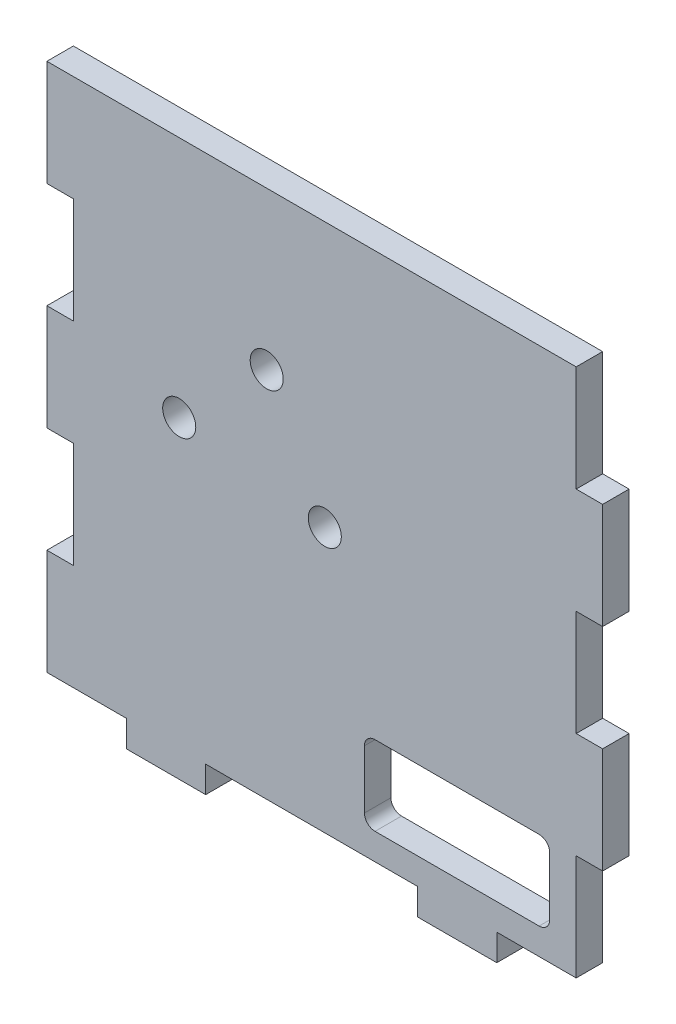
from build123d import *

# Parameters (mm, degrees)
BOXSIDE_DEPTH      = 6.35
SKETCH2_R          = 3.96875
CUT_EXTRUDE1_DEPTH = 99.986703653
SKETCH3_W          = 44.45
SKETCH3_H          = 19.05
CUT_EXTRUDE2_DEPTH = 99.986703653
FILLET1_R          = 2.54


with BuildPart() as part:
    # Sketch1 → BOXSIDE (new body)
    with BuildSketch(Plane.XY):
        Polygon((-63.5, 38.1), (-63.5, 63.5), (63.5, 63.5), (63.5, 38.1), (69.85, 38.1), (69.85, 12.7), (63.5, 12.7), (63.5, -12.7), (69.85, -12.7), (69.85, -38.1), (63.5, -38.1), (63.5, -63.5), (44.45, -63.5), (44.45, -69.85), (25.4, -69.85), (25.4, -63.5), (-25.4, -63.5), (-25.4, -69.85), (-44.45, -69.85), (-44.45, -63.5), (-63.5, -63.5), (-63.5, -38.1), (-57.15, -38.1), (-57.15, -12.7), (-63.5, -12.7), (-63.5, 12.7), (-57.15, 12.7), (-57.15, 38.1), align=None)
    extrude(amount=BOXSIDE_DEPTH)

    # Sketch2 → Cut-Extrude1 (cut, through all)
    with BuildSketch(Plane.XY):
        with Locations(Location((-10.755250883, 25.77544668, 0), (0, 0, 180))):
            Circle(SKETCH2_R)
        with Locations((3.175, 0)):
            Circle(SKETCH2_R)
        with Locations((-31.75, 5.339056325)):
            Circle(SKETCH2_R)
    extrude(amount=CUT_EXTRUDE1_DEPTH, mode=Mode.SUBTRACT)

    # Sketch3 → Cut-Extrude2 (cut, through all)
    with BuildSketch(Plane(origin=(0, 0, 0), x_dir=(-1, 0, 0), z_dir=(0, 0, -1))):
        with Locations((-34.925, -47.625)):
            Rectangle(SKETCH3_W, SKETCH3_H)
    extrude(amount=-CUT_EXTRUDE2_DEPTH, mode=Mode.SUBTRACT)

    # Fillet1
    fillet1_edges = [part.edges().sort_by_distance(p)[0] for p in [
        (57.15, -57.15, 3.175),
        (57.15, -38.1, 3.175),
        (12.7, -38.1, 3.175),
        (12.7, -57.15, 3.175),
    ]]
    fillet(fillet1_edges, radius=FILLET1_R)


solid = part.part
